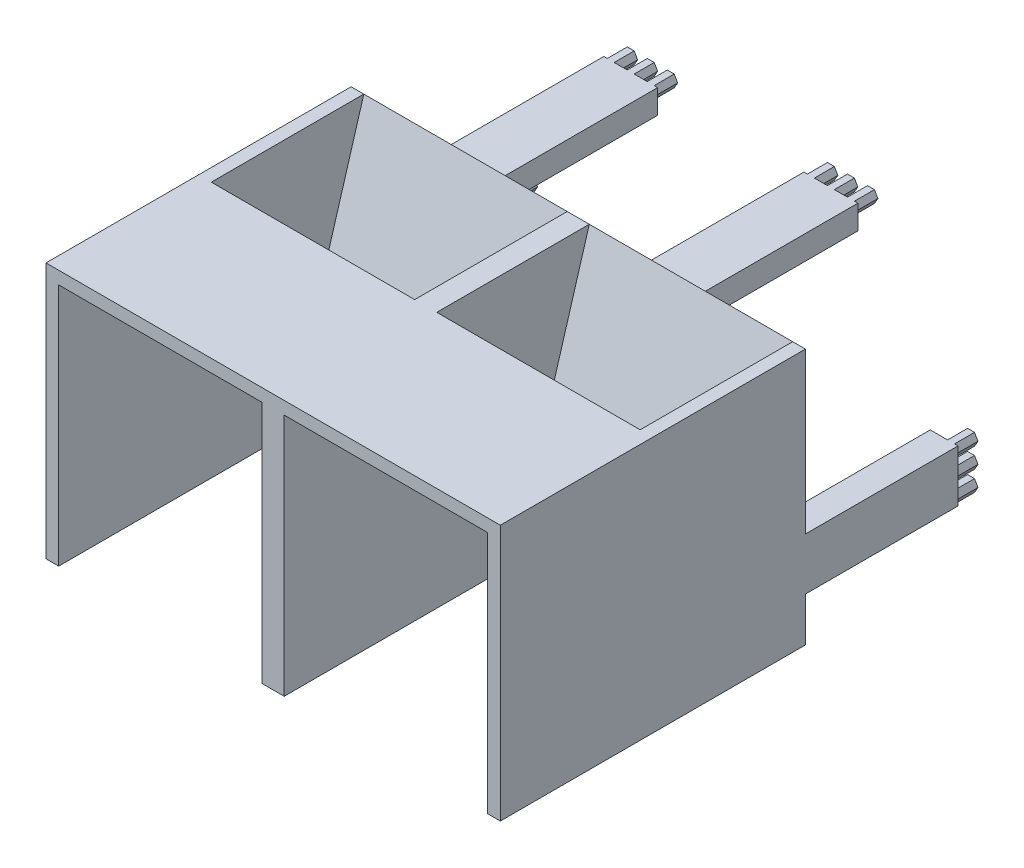
from build123d import *

# Parameters (mm, degrees)
BOSS_EXTRUDE5_DEPTH    = 10
BOSS_EXTRUDE5_2_DEPTH  = 10
BOSS_EXTRUDE5_3_DEPTH  = 10
BOSS_EXTRUDE5_4_DEPTH  = 10
BOSS_EXTRUDE5_5_DEPTH  = 10
BOSS_EXTRUDE5_6_DEPTH  = 10
BOSS_EXTRUDE5_7_DEPTH  = 10
BOSS_EXTRUDE5_8_DEPTH  = 10
BOSS_EXTRUDE5_9_DEPTH  = 10
BOSS_EXTRUDE5_10_DEPTH = 10
BOSS_EXTRUDE5_11_DEPTH = 10
BOSS_EXTRUDE5_12_DEPTH = 10
SKETCH5_W              = 13.85640646
SKETCH5_H              = 26
SKETCH5_W_2            = 26.92820323
SKETCH5_H_2            = 12
BOSS_EXTRUDE8_DEPTH    = 76.2
BOSS_EXTRUDE9_REACH    = 266.711
SKETCH9_W              = 6.35
SKETCH9_H              = 128.000000074
SKETCH9_W_2            = 11.02820323
BOSS_EXTRUDE10_DEPTH   = 152.4
SKETCH11_W             = 226.92820323
SKETCH11_H             = 76.2
BOSS_EXTRUDE11_DEPTH   = 6.35


with BuildPart() as part:
    # Sketch2 → Boss-Extrude5 (new body)
    with BuildSketch(Plane.XY):
        Polygon((-111.732050808, 13), (-113.464101615, 10), (-111.732050808, 7), (-108.267949192, 7), (-106.535898385, 10), (-108.267949192, 13), align=None)
    extrude(amount=-BOSS_EXTRUDE5_DEPTH)



with BuildPart() as body_2:
    # Sketch2 → Boss-Extrude5 2 (new body)
    with BuildSketch(Plane.XY):
        Polygon((-111.732050808, 23), (-113.464101615, 20), (-111.732050808, 17), (-108.267949192, 17), (-106.535898385, 20), (-108.267949192, 23), align=None)
    extrude(amount=-BOSS_EXTRUDE5_2_DEPTH)


with BuildPart() as body_3:
    # Sketch2 → Boss-Extrude5 3 (new body)
    with BuildSketch(Plane.XY):
        Polygon((-111.732050808, 33), (-113.464101615, 30), (-111.732050808, 27), (-108.267949192, 27), (-106.535898385, 30), (-108.267949192, 33), align=None)
    extrude(amount=-BOSS_EXTRUDE5_3_DEPTH)


with BuildPart() as body_4:
    # Sketch2 → Boss-Extrude5 4 (new body)
    with BuildSketch(Plane.XY):
        Polygon((111.732050808, 27), (113.464101615, 30), (111.732050808, 33), (108.267949192, 33), (106.535898385, 30), (108.267949192, 27), align=None)
    extrude(amount=-BOSS_EXTRUDE5_4_DEPTH)


with BuildPart() as body_5:
    # Sketch2 → Boss-Extrude5 5 (new body)
    with BuildSketch(Plane.XY):
        Polygon((111.732050808, 17), (113.464101615, 20), (111.732050808, 23), (108.267949192, 23), (106.535898385, 20), (108.267949192, 17), align=None)
    extrude(amount=-BOSS_EXTRUDE5_5_DEPTH)


with BuildPart() as body_6:
    # Sketch2 → Boss-Extrude5 6 (new body)
    with BuildSketch(Plane.XY):
        Polygon((111.732050808, 7), (113.464101615, 10), (111.732050808, 13), (108.267949192, 13), (106.535898385, 10), (108.267949192, 7), align=None)
    extrude(amount=-BOSS_EXTRUDE5_6_DEPTH)


with BuildPart() as body_7:
    # Sketch2 → Boss-Extrude5 7 (new body)
    with BuildSketch(Plane.XY):
        Polygon((61.732050808, 107), (63.464101615, 110), (61.732050808, 113), (58.267949192, 113), (56.535898385, 110), (58.267949192, 107), align=None)
    extrude(amount=-BOSS_EXTRUDE5_7_DEPTH)


with BuildPart() as body_8:
    # Sketch2 → Boss-Extrude5 8 (new body)
    with BuildSketch(Plane.XY):
        Polygon((51.732050808, 107), (53.464101615, 110), (51.732050808, 113), (48.267949192, 113), (46.535898385, 110), (48.267949192, 107), align=None)
    extrude(amount=-BOSS_EXTRUDE5_8_DEPTH)


with BuildPart() as body_9:
    # Sketch2 → Boss-Extrude5 9 (new body)
    with BuildSketch(Plane.XY):
        Polygon((41.732050808, 107), (43.464101615, 110), (41.732050808, 113), (38.267949192, 113), (36.535898385, 110), (38.267949192, 107), align=None)
    extrude(amount=-BOSS_EXTRUDE5_9_DEPTH)


with BuildPart() as body_10:
    # Sketch2 → Boss-Extrude5 10 (new body)
    with BuildSketch(Plane.XY):
        Polygon((-38.267949192, 107), (-36.535898385, 110), (-38.267949192, 113), (-41.732050808, 113), (-43.464101615, 110), (-41.732050808, 107), align=None)
    extrude(amount=-BOSS_EXTRUDE5_10_DEPTH)


with BuildPart() as body_11:
    # Sketch2 → Boss-Extrude5 11 (new body)
    with BuildSketch(Plane.XY):
        Polygon((-48.267949192, 107), (-46.535898385, 110), (-48.267949192, 113), (-51.732050808, 113), (-53.464101615, 110), (-51.732050808, 107), align=None)
    extrude(amount=-BOSS_EXTRUDE5_11_DEPTH)


with BuildPart() as body_12:
    # Sketch2 → Boss-Extrude5 12 (new body)
    with BuildSketch(Plane.XY):
        Polygon((-58.267949192, 107), (-56.535898385, 110), (-58.267949192, 113), (-61.732050808, 113), (-63.464101615, 110), (-61.732050808, 107), align=None)
    extrude(amount=-BOSS_EXTRUDE5_12_DEPTH)


with BuildPart() as part_1:
    add(part.part)

    add(body_2.part)  # Boss-Extrude8 merges body 2

    add(body_3.part)  # Boss-Extrude8 merges body 3

    add(body_4.part)  # Boss-Extrude8 merges body 4

    add(body_5.part)  # Boss-Extrude8 merges body 5

    add(body_6.part)  # Boss-Extrude8 merges body 6

    add(body_7.part)  # Boss-Extrude8 merges body 7

    add(body_8.part)  # Boss-Extrude8 merges body 8

    add(body_9.part)  # Boss-Extrude8 merges body 9

    add(body_10.part)  # Boss-Extrude8 merges body 10

    add(body_11.part)  # Boss-Extrude8 merges body 11

    add(body_12.part)  # Boss-Extrude8 merges body 12
    # Sketch5 → Boss-Extrude8 (add)
    with BuildSketch(Plane.XY):
        with Locations((-106.535898385, 20)):
            Rectangle(SKETCH5_W, SKETCH5_H)
        with Locations((-50, 107)):
            Rectangle(SKETCH5_W_2, SKETCH5_H_2)
        with Locations((50, 107)):
            Rectangle(SKETCH5_W_2, SKETCH5_H_2)
        with Locations((106.535898385, 20)):
            Rectangle(SKETCH5_W, SKETCH5_H)
    extrude(amount=BOSS_EXTRUDE8_DEPTH)

    # Boss-Extrude9: up to this face of the body (flat: up to its plane)
    boss_extrude9_end = Plane(part_1.part.faces().sort_by_distance((-113.464101615, 20, 38.1))[0])
    # Sketch8 → Boss-Extrude9 (add, up to the picked face)
    with BuildSketch(Plane(origin=(113.464101615, 0, 0), x_dir=(0, 0, -1), z_dir=(1, 0, 0)), mode=Mode.PRIVATE) as boss_extrude9_sk1:
        Polygon((-76.2, 113), (-76.2, -15.000000074), (-114.3, -15.000000074), align=None)
    boss_extrude9_tool1 = split(extrude(boss_extrude9_sk1.sketch, amount=-BOSS_EXTRUDE9_REACH, mode=Mode.PRIVATE), bisect_by=boss_extrude9_end, keep=Keep.BOTH, mode=Mode.PRIVATE)
    add(boss_extrude9_tool1.solids().sort_by(Axis((113.464102, 27.666667, 88.9), (-1, 0, 0)))[0])

    # Sketch9 → Boss-Extrude10 (add)
    with BuildSketch(Plane(origin=(0, 0, 76.2), x_dir=(-1, 0, 0), z_dir=(0, 0, -1))):
        with Locations((-110.289101615, 48.999999963)):
            Rectangle(SKETCH9_W, SKETCH9_H)
        with Locations((110.289101615, 48.999999963)):
            Rectangle(SKETCH9_W, SKETCH9_H)
        with Locations((0, 48.999999963)):
            Rectangle(SKETCH9_W_2, SKETCH9_H)
    extrude(amount=-BOSS_EXTRUDE10_DEPTH)

    # Sketch11 → Boss-Extrude11 (add)
    with BuildSketch(Plane(origin=(0, 113, 0), x_dir=(1, 0, 0), z_dir=(0, 1, 0))):
        with Locations((0, -190.5)):
            Rectangle(SKETCH11_W, SKETCH11_H)
    extrude(amount=-BOSS_EXTRUDE11_DEPTH)


solid = part_1.part
